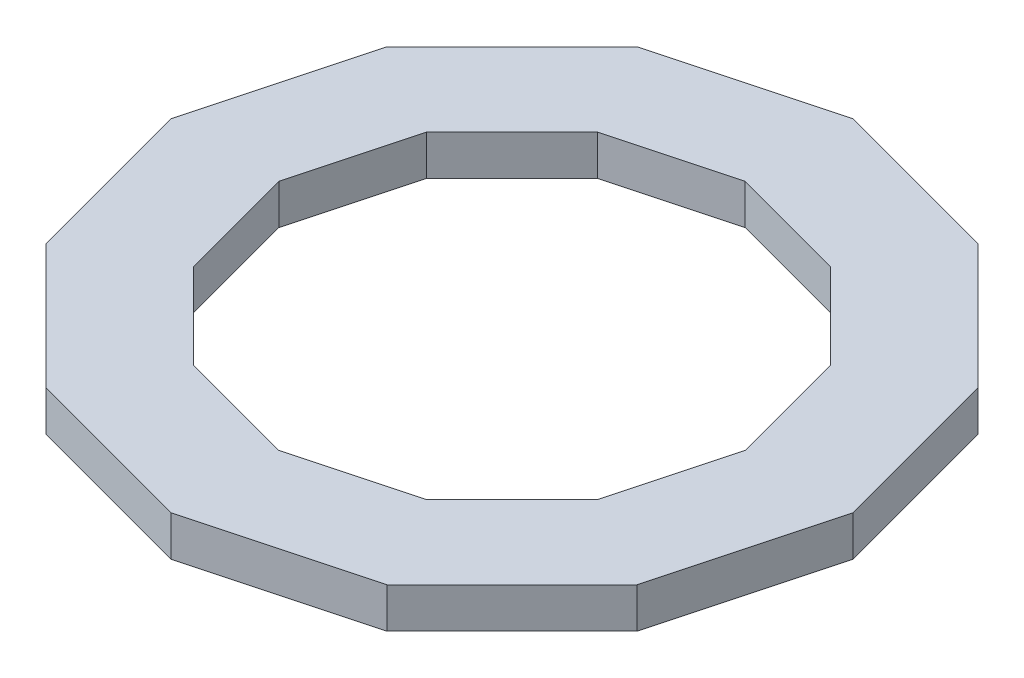
from build123d import *

# Parameters (mm, degrees)
BOSS_EXTRUDE2_DEPTH = 19.05


with BuildPart() as part:
    # Sketch2 → Boss-Extrude2 (new body)
    with BuildSketch(Plane(origin=(0, 0, 0), x_dir=(1, 0, 0), z_dir=(0, 1, 0))):
        Polygon((-161.927805519, 0), (-140.233593159, -80.96390276), (-80.96390276, -140.233593159), (0, -161.927805519), (80.96390276, -140.233593159), (140.233593159, -80.96390276), (161.927805519, 0), (140.233593159, 80.96390276), (80.96390276, 140.233593159), (0, 161.927805519), (-80.96390276, 140.233593159), (-140.233593159, 80.96390276), align=None)
        Polygon((-110.650576303, 0), (-95.826210022, -55.325288152), (-55.325288152, -95.826210022), (0, -110.650576303), (55.325288152, -95.826210022), (95.826210022, -55.325288152), (110.650576303, 0), (95.826210022, 55.325288152), (55.325288152, 95.826210022), (0, 110.650576303), (-55.325288152, 95.826210022), (-95.826210022, 55.325288152), align=None, mode=Mode.SUBTRACT)
    extrude(amount=BOSS_EXTRUDE2_DEPTH)


solid = part.part
